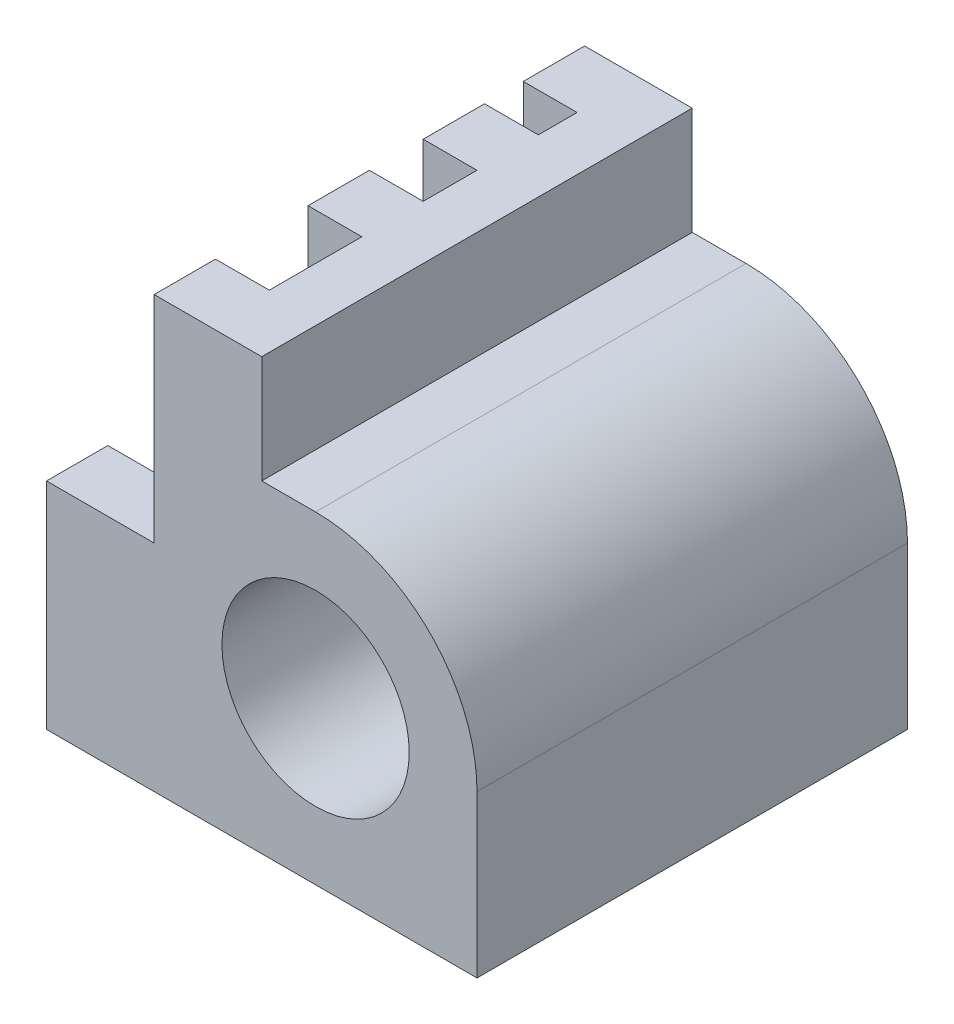
from build123d import *

# Parameters (mm, degrees)
SKETCH1_R           = 4.35
BOSS_EXTRUDE1_DEPTH = 20
SKETCH2_W           = 7.5
SKETCH2_H           = 1.8
SKETCH2_H_2         = 2.5
SKETCH2_H_3         = 4.3
CUT_EXTRUDE1_DEPTH  = 12.5


with BuildPart() as part:
    # Sketch1 → Boss-Extrude1 (new body)
    with BuildSketch(Plane.XY):
        with BuildLine():
            Line((0, 0), (20, 0))
            Line((20, 0), (20, 7.5))
            ThreePointArc((20, 7.5), (17.803300859, 12.803300859), (12.5, 15))
            Line((12.5, 15), (10, 15))
            Line((10, 15), (10, 20))
            Line((10, 20), (5, 20))
            Line((5, 20), (5, 10))
            Line((5, 10), (0, 10))
            Line((0, 10), (0, 0))
        make_face()
        with Locations((12.5, 7.5)):
            Circle(SKETCH1_R, mode=Mode.SUBTRACT)
    extrude(amount=BOSS_EXTRUDE1_DEPTH)

    # Sketch2 → Cut-Extrude1 (cut)
    with BuildSketch(Plane(origin=(0, 20, 0), x_dir=(1, 0, 0), z_dir=(0, 1, 0))):
        with Locations((3.75, -3.75)):
            Rectangle(SKETCH2_W, SKETCH2_H)
        with Locations((3.75, -8.75)):
            Rectangle(SKETCH2_W, SKETCH2_H_2)
        with Locations((3.75, -15)):
            Rectangle(SKETCH2_W, SKETCH2_H_3)
    extrude(amount=-CUT_EXTRUDE1_DEPTH, mode=Mode.SUBTRACT)


solid = part.part
